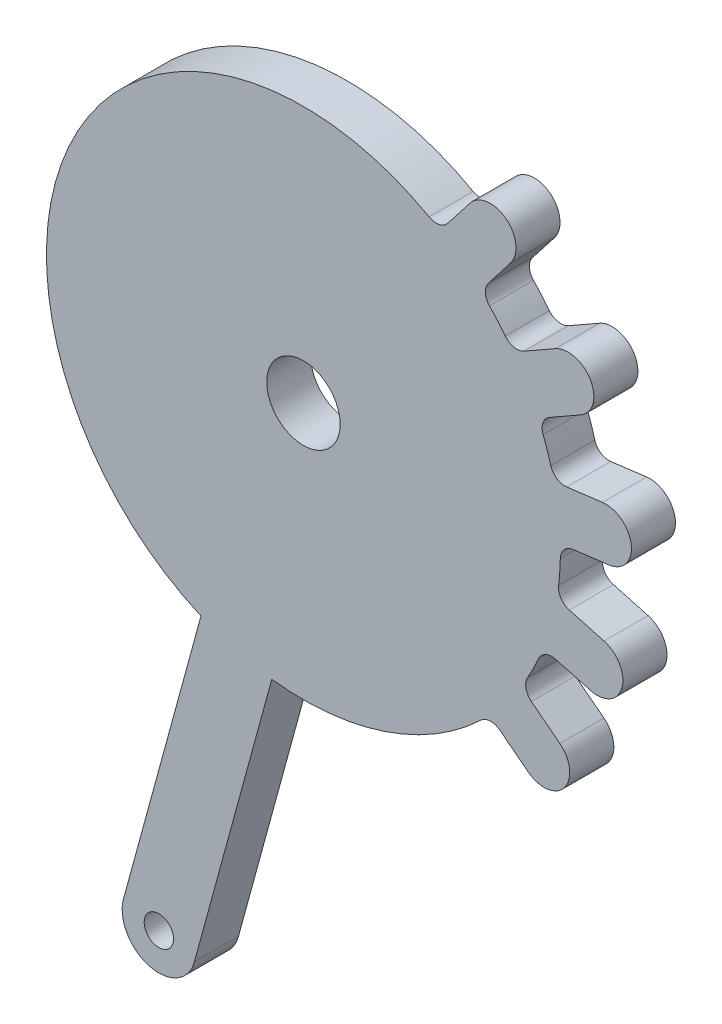
from build123d import *

# Parameters (mm, degrees)
SKETCH1_R           = 17.5
SKETCH1_R_2         = 2.5
SKETCH1_R_3         = 1.75
SKETCH1_R_4         = 1
BOSS_EXTRUDE1_DEPTH = 3
FILLET1_R           = 1


with BuildPart() as part:
    # Sketch1 → Boss-Extrude1 (new body)
    # profile 1 of 13: a face of its own
    with BuildSketch(Plane.XY):
        with Locations((45.07, -38)):
            Circle(SKETCH1_R)
        with Locations((45.07, -38)):
            Circle(SKETCH1_R_2, mode=Mode.SUBTRACT)
    # profile 2 of 13: a face of its own
    with BuildSketch(Plane.XY):
        with BuildLine():
            ThreePointArc((59.178313279, -22.683979093), (56.722798651, -22.992925548), (56.413852196, -20.53741092))
            Line((56.413852196, -20.53741092), (54.366811281, -23.173695673))
            ThreePointArc((54.366811281, -23.173695673), (55.802840863, -24.177694584), (57.131272364, -25.320263845))
            Line((57.131272364, -25.320263845), (59.178313279, -22.683979093))
        make_face()
    # profile 3 of 13: a face of its own
    with BuildSketch(Plane.XY):
        with Locations((57.796082737, -21.610695007)):
            Circle(SKETCH1_R_3)
    # profile 4 of 13: a face of its own
    with BuildSketch(Plane.XY):
        with Locations((63.099282859, -27.728317587)):
            Circle(SKETCH1_R_3)
    # profile 5 of 13: a face of its own
    with BuildSketch(Plane.XY):
        with BuildLine():
            Line((62.23299639, -26.207775659), (59.33291469, -27.860016541))
            ThreePointArc((59.33291469, -27.860016541), (60.275419279, -29.337135314), (61.065487627, -30.901100396))
            Line((61.065487627, -30.901100396), (63.965569327, -29.248859515))
            ThreePointArc((63.965569327, -29.248859515), (61.578740931, -28.594604056), (62.23299639, -26.207775659))
        make_face()
    # profile 6 of 13: a face of its own
    with BuildSketch(Plane.XY):
        with BuildLine():
            ThreePointArc((65.876146235, -37.146021746), (63.921377057, -35.628168835), (65.439229968, -33.673399657))
            Line((65.439229968, -33.673399657), (62.12761863, -34.090057971))
            ThreePointArc((62.12761863, -34.090057971), (62.433110447, -35.815418664), (62.564534897, -37.56268006))
            Line((62.564534897, -37.56268006), (65.876146235, -37.146021746))
        make_face()
    # profile 7 of 13: a face of its own
    with BuildSketch(Plane.XY):
        with Locations((65.657688101, -35.409710702)):
            Circle(SKETCH1_R_3)
    # profile 8 of 13: a face of its own
    with BuildSketch(Plane.XY):
        with BuildLine():
            ThreePointArc((62.325454762, -40.915352631), (61.947425446, -42.626284719), (61.400197818, -44.29083772))
            Line((61.400197818, -44.29083772), (64.619175986, -45.173194426))
            ThreePointArc((64.619175986, -45.173194426), (63.394061913, -43.022823409), (65.54443293, -41.797709336))
            Line((65.54443293, -41.797709336), (62.325454762, -40.915352631))
        make_face()
    # profile 9 of 13: a face of its own
    with BuildSketch(Plane.XY):
        with Locations((65.081804458, -43.485451881)):
            Circle(SKETCH1_R_3)
    # profile 10 of 13: a face of its own
    with BuildSketch(Plane.XY):
        with Locations((61.459304993, -50.726082737)):
            Circle(SKETCH1_R_3)
    # profile 11 of 13: a face of its own
    with BuildSketch(Plane.XY):
        with BuildLine():
            ThreePointArc((59.896304327, -47.296811281), (58.892305416, -48.732840863), (57.749736155, -50.061272364))
            Line((57.749736155, -50.061272364), (60.386020907, -52.108313279))
            ThreePointArc((60.386020907, -52.108313279), (60.077074452, -49.652798651), (62.53258908, -49.343852196))
            Line((62.53258908, -49.343852196), (59.896304327, -47.296811281))
        make_face()
    # profile 12 of 13: a face of its own
    with BuildSketch(Plane.XY):
        with BuildLine():
            ThreePointArc((42.917509319, -55.367117892), (40.458569889, -54.881490228), (38.094226397, -54.049566432))
            Line((38.094226397, -54.049566432), (36.76608928, -58.911601248))
            ThreePointArc((36.76608928, -58.911601248), (39.141018428, -59.704773151), (41.589372203, -60.229152708))
            Line((41.589372203, -60.229152708), (42.917509319, -55.367117892))
        make_face()
    # profile 13 of 13: a face of its own
    with BuildSketch(Plane.XY):
        with BuildLine():
            ThreePointArc((41.589372203, -60.229152708), (39.141018428, -59.704773151), (36.76608928, -58.911601248))
            Line((36.76608928, -58.911601248), (32.824020556, -73.342698121))
            ThreePointArc((32.824020556, -73.342698121), (34.567840149, -76.446231348), (37.647303478, -74.660249581))
            Line((37.647303478, -74.660249581), (41.589372203, -60.229152708))
        make_face()
        with Locations((35.226677147, -74.034365596)):
            Circle(SKETCH1_R_4, mode=Mode.SUBTRACT)
    extrude(amount=BOSS_EXTRUDE1_DEPTH)

    # Fillet1
    fillet1_edges = [part.edges().sort_by_distance(p)[0] for p in [
        (62.325454762, -40.915352631, 1.5),
        (61.400197818, -44.29083772, 1.5),
        (59.896304327, -47.296811281, 1.5),
        (57.749736155, -50.061272364, 1.5),
        (54.366811281, -23.173695673, 1.5),
        (57.131272364, -25.320263845, 1.5),
        (59.33291469, -27.860016541, 1.5),
        (61.065487627, -30.901100396, 1.5),
        (62.12761863, -34.090057971, 1.5),
        (62.564534897, -37.56268006, 1.5),
    ]]
    fillet(fillet1_edges, radius=FILLET1_R)


solid = part.part
